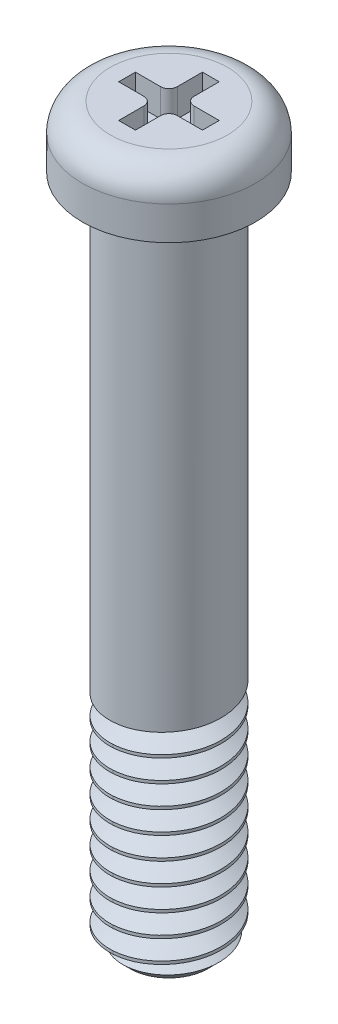
from build123d import *

# Parameters (mm, degrees)
SKETCH_1_R          = 1.55
EXTRUDE_1_DEPTH     = 1.1
SKETCH_2_R          = 1
EXTRUDE_2_DEPTH     = 12
CHAMFER_1_SIZE      = 0.3
SWEEP_1_PITCH       = 0.4
SWEEP_1_HEIGHT      = 4
SWEEP_1_RADIUS      = 1
SWEEP_1_START_ANGLE = -180
FILLET_2_R          = 0.5
CUT_EXTRUDE_1_DEPTH = 0.5


with BuildPart() as part:
    # 草图1 → 凸台-拉伸1 (new body)
    with BuildSketch(Plane(origin=(0, 0, 0), x_dir=(1, 0, 0), z_dir=(0, 1, 0))):
        with Locations(Location((0, 0, 0), (0, 0, 270))):
            Circle(SKETCH_1_R)
    extrude(amount=EXTRUDE_1_DEPTH)

    # 草图2 → 凸台-拉伸2 (add)
    with BuildSketch(Plane.XZ):
        with Locations(Location((0, 0, 0), (0, 0, 90))):
            Circle(SKETCH_2_R)
    extrude(amount=EXTRUDE_2_DEPTH)

    # 倒角1
    chamfer_1_edges = [part.edges().sort_by_distance(p)[0] for p in [
        (0, -12, -1),
    ]]
    chamfer(chamfer_1_edges, length=CHAMFER_1_SIZE)

    # 切除-扫描1: sweep along a helix
    with BuildLine() as sweep_1_path:
        add(Helix(SWEEP_1_PITCH, SWEEP_1_HEIGHT, SWEEP_1_RADIUS, center=(0, -12, 0), direction=(0, 1, 0), mode=Mode.PRIVATE).rotate(Axis((0, -12, 0), (0, 1, 0)), SWEEP_1_START_ANGLE))
    # 草图5 → 切除-扫描1 (sweep, cut)
    with BuildSketch(Plane(origin=(0, 0, 0), x_dir=(0, 0, -1), z_dir=(1, 0, 0))):
        Polygon((1.142011579, -11.744804496), (0.7, -12), (1.142011579, -12.255195504), align=None)
    sweep(path=sweep_1_path.line, is_frenet=True, mode=Mode.SUBTRACT)

    # 圆角2
    fillet_2_edges = [part.edges().sort_by_distance(p)[0] for p in [
        (0, 1.1, -1.55),
    ]]
    fillet(fillet_2_edges, radius=FILLET_2_R)

    # 草图6 → 切除-拉伸1 (cut)
    with BuildSketch(Plane(origin=(0, 1.1, 0), x_dir=(1, 0, 0), z_dir=(0, 1, 0))):
        with BuildLine():
            Line((-0.15, 0.75), (0.15, 0.75))
            Line((0.15, 0.75), (0.15, 0.3))
            ThreePointArc((0.15, 0.3), (0.193933983, 0.193933983), (0.3, 0.15))
            Line((0.3, 0.15), (0.75, 0.15))
            Line((0.75, 0.15), (0.75, -0.15))
            Line((0.75, -0.15), (0.3, -0.15))
            ThreePointArc((0.3, -0.15), (0.193933983, -0.193933983), (0.15, -0.3))
            Line((0.15, -0.3), (0.15, -0.75))
            Line((0.15, -0.75), (-0.15, -0.75))
            Line((-0.15, -0.75), (-0.15, -0.3))
            ThreePointArc((-0.15, -0.3), (-0.193933983, -0.193933983), (-0.3, -0.15))
            Line((-0.3, -0.15), (-0.75, -0.15))
            Line((-0.75, -0.15), (-0.75, 0.15))
            Line((-0.75, 0.15), (-0.3, 0.15))
            ThreePointArc((-0.3, 0.15), (-0.193933983, 0.193933983), (-0.15, 0.3))
            Line((-0.15, 0.3), (-0.15, 0.75))
        make_face()
    extrude(amount=-CUT_EXTRUDE_1_DEPTH, mode=Mode.SUBTRACT)


solid = part.part
